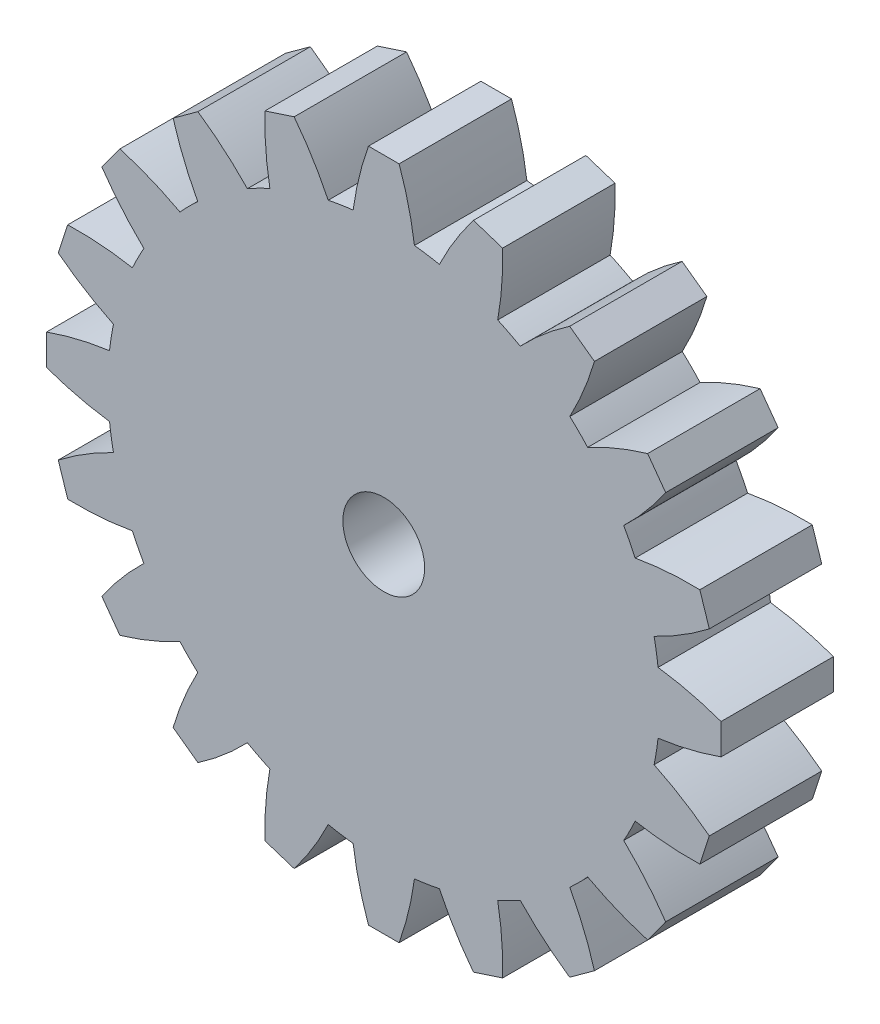
from build123d import *

# Parameters (mm, degrees)
SKETCH_1_R          = 13.5
EXTRUDE_1_DEPTH     = 5.5
EXTRUDE_START       = -5.5
EXTRUDE_2_DEPTH     = 5.5
SKETCH_7_R          = 2
CUT_EXTRUDE_1_DEPTH = 24.973944189
SKETCH_8_R          = 12.5
SKETCH_8_R_2        = 3
CUT_EXTRUDE_2_DEPTH = 4


with BuildPart() as part:
    # 草图1 → 凸台-拉伸1 (new body)
    with BuildSketch(Plane.XY):
        Circle(SKETCH_1_R)
    extrude(amount=EXTRUDE_1_DEPTH)

    # 草图6 → 凸台-拉伸2 (add)
    with BuildSketch(Plane.XY.offset(5.5).offset(EXTRUDE_START)):
        with BuildLine():
            Line((5.812072794, 15.460669773), (4.38548802, 15.924195265))
            ThreePointArc((4.38548802, 15.924195265), (3.48195608, 14.617198294), (2.719313259, 13.223287617))
            ThreePointArc((2.719313259, 13.223287617), (4.171729424, 12.83926297), (5.572482808, 12.296236634))
            ThreePointArc((5.572482808, 12.296236634), (5.774811944, 13.872204263), (5.812072794, 15.460669773))
        make_face()
        with BuildLine():
            Line((10.305219409, 12.907941468), (9.091693917, 13.789619346))
            ThreePointArc((9.091693917, 13.789619346), (7.828499702, 12.825798085), (6.67244119, 11.735779845))
            ThreePointArc((6.67244119, 11.735779845), (7.935100906, 10.921729424), (9.099492173, 9.972424088))
            ThreePointArc((9.099492173, 9.972424088), (9.778919397, 11.40873523), (10.305219409, 12.907941468))
        make_face()
        with BuildLine():
            Line((0.75, 16.5), (-0.75, 16.5))
            ThreePointArc((-0.75, 16.5), (-1.205425663, 14.97776529), (-1.5, 13.416407865))
            ThreePointArc((-1.5, 13.416407865), (0, 13.5), (1.5, 13.416407865))
            ThreePointArc((1.5, 13.416407865), (1.205425663, 14.97776529), (0.75, 16.5))
        make_face()
        with BuildLine():
            Line((13.789619346, 9.091693917), (12.907941468, 10.305219409))
            ThreePointArc((12.907941468, 10.305219409), (11.40873523, 9.778919397), (9.972424088, 9.099492173))
            ThreePointArc((9.972424088, 9.099492173), (10.921729424, 7.935100906), (11.735779845, 6.67244119))
            ThreePointArc((11.735779845, 6.67244119), (12.825798085, 7.828499702), (13.789619346, 9.091693917))
        make_face()
        with BuildLine():
            Line((15.924195265, 4.38548802), (15.460669773, 5.812072794))
            ThreePointArc((15.460669773, 5.812072794), (13.872204263, 5.774811944), (12.296236634, 5.572482808))
            ThreePointArc((12.296236634, 5.572482808), (12.83926297, 4.171729424), (13.223287617, 2.719313259))
            ThreePointArc((13.223287617, 2.719313259), (14.617198294, 3.48195608), (15.924195265, 4.38548802))
        make_face()
        with BuildLine():
            Line((16.5, -0.75), (16.5, 0.75))
            ThreePointArc((16.5, 0.75), (14.97776529, 1.205425663), (13.416407865, 1.5))
            ThreePointArc((13.416407865, 1.5), (13.5, 0), (13.416407865, -1.5))
            ThreePointArc((13.416407865, -1.5), (14.97776529, -1.205425663), (16.5, -0.75))
        make_face()
        with BuildLine():
            Line((15.460669773, -5.812072794), (15.924195265, -4.38548802))
            ThreePointArc((15.924195265, -4.38548802), (14.617198294, -3.48195608), (13.223287617, -2.719313259))
            ThreePointArc((13.223287617, -2.719313259), (12.83926297, -4.171729424), (12.296236634, -5.572482808))
            ThreePointArc((12.296236634, -5.572482808), (13.872204263, -5.774811944), (15.460669773, -5.812072794))
        make_face()
        with BuildLine():
            Line((12.907941468, -10.305219409), (13.789619346, -9.091693917))
            ThreePointArc((13.789619346, -9.091693917), (12.825798085, -7.828499702), (11.735779845, -6.67244119))
            ThreePointArc((11.735779845, -6.67244119), (10.921729424, -7.935100906), (9.972424088, -9.099492173))
            ThreePointArc((9.972424088, -9.099492173), (11.40873523, -9.778919397), (12.907941468, -10.305219409))
        make_face()
        with BuildLine():
            Line((9.091693917, -13.789619346), (10.305219409, -12.907941468))
            ThreePointArc((10.305219409, -12.907941468), (9.778919397, -11.40873523), (9.099492173, -9.972424088))
            ThreePointArc((9.099492173, -9.972424088), (7.935100906, -10.921729424), (6.67244119, -11.735779845))
            ThreePointArc((6.67244119, -11.735779845), (7.828499702, -12.825798085), (9.091693917, -13.789619346))
        make_face()
        with BuildLine():
            Line((4.38548802, -15.924195265), (5.812072794, -15.460669773))
            ThreePointArc((5.812072794, -15.460669773), (5.774811944, -13.872204263), (5.572482808, -12.296236634))
            ThreePointArc((5.572482808, -12.296236634), (4.171729424, -12.83926297), (2.719313259, -13.223287617))
            ThreePointArc((2.719313259, -13.223287617), (3.48195608, -14.617198294), (4.38548802, -15.924195265))
        make_face()
        with BuildLine():
            Line((-0.75, -16.5), (0.75, -16.5))
            ThreePointArc((0.75, -16.5), (1.205425663, -14.97776529), (1.5, -13.416407865))
            ThreePointArc((1.5, -13.416407865), (0, -13.5), (-1.5, -13.416407865))
            ThreePointArc((-1.5, -13.416407865), (-1.205425663, -14.97776529), (-0.75, -16.5))
        make_face()
        with BuildLine():
            Line((-5.812072794, -15.460669773), (-4.38548802, -15.924195265))
            ThreePointArc((-4.38548802, -15.924195265), (-3.48195608, -14.617198294), (-2.719313259, -13.223287617))
            ThreePointArc((-2.719313259, -13.223287617), (-4.171729424, -12.83926297), (-5.572482808, -12.296236634))
            ThreePointArc((-5.572482808, -12.296236634), (-5.774811944, -13.872204263), (-5.812072794, -15.460669773))
        make_face()
        with BuildLine():
            Line((-10.305219409, -12.907941468), (-9.091693917, -13.789619346))
            ThreePointArc((-9.091693917, -13.789619346), (-7.828499702, -12.825798085), (-6.67244119, -11.735779845))
            ThreePointArc((-6.67244119, -11.735779845), (-7.935100906, -10.921729424), (-9.099492173, -9.972424088))
            ThreePointArc((-9.099492173, -9.972424088), (-9.778919397, -11.40873523), (-10.305219409, -12.907941468))
        make_face()
        with BuildLine():
            Line((-13.789619346, -9.091693917), (-12.907941468, -10.305219409))
            ThreePointArc((-12.907941468, -10.305219409), (-11.40873523, -9.778919397), (-9.972424088, -9.099492173))
            ThreePointArc((-9.972424088, -9.099492173), (-10.921729424, -7.935100906), (-11.735779845, -6.67244119))
            ThreePointArc((-11.735779845, -6.67244119), (-12.825798085, -7.828499702), (-13.789619346, -9.091693917))
        make_face()
        with BuildLine():
            Line((-15.924195265, -4.38548802), (-15.460669773, -5.812072794))
            ThreePointArc((-15.460669773, -5.812072794), (-13.872204263, -5.774811944), (-12.296236634, -5.572482808))
            ThreePointArc((-12.296236634, -5.572482808), (-12.83926297, -4.171729424), (-13.223287617, -2.719313259))
            ThreePointArc((-13.223287617, -2.719313259), (-14.617198294, -3.48195608), (-15.924195265, -4.38548802))
        make_face()
        with BuildLine():
            Line((-16.5, 0.75), (-16.5, -0.75))
            ThreePointArc((-16.5, -0.75), (-14.97776529, -1.205425663), (-13.416407865, -1.5))
            ThreePointArc((-13.416407865, -1.5), (-13.5, 0), (-13.416407865, 1.5))
            ThreePointArc((-13.416407865, 1.5), (-14.97776529, 1.205425663), (-16.5, 0.75))
        make_face()
        with BuildLine():
            Line((-15.460669773, 5.812072794), (-15.924195265, 4.38548802))
            ThreePointArc((-15.924195265, 4.38548802), (-14.617198294, 3.48195608), (-13.223287617, 2.719313259))
            ThreePointArc((-13.223287617, 2.719313259), (-12.83926297, 4.171729424), (-12.296236634, 5.572482808))
            ThreePointArc((-12.296236634, 5.572482808), (-13.872204263, 5.774811944), (-15.460669773, 5.812072794))
        make_face()
        with BuildLine():
            Line((-12.907941468, 10.305219409), (-13.789619346, 9.091693917))
            ThreePointArc((-13.789619346, 9.091693917), (-12.825798085, 7.828499702), (-11.735779845, 6.67244119))
            ThreePointArc((-11.735779845, 6.67244119), (-10.921729424, 7.935100906), (-9.972424088, 9.099492173))
            ThreePointArc((-9.972424088, 9.099492173), (-11.40873523, 9.778919397), (-12.907941468, 10.305219409))
        make_face()
        with BuildLine():
            Line((-9.091693917, 13.789619346), (-10.305219409, 12.907941468))
            ThreePointArc((-10.305219409, 12.907941468), (-9.778919397, 11.40873523), (-9.099492173, 9.972424088))
            ThreePointArc((-9.099492173, 9.972424088), (-7.935100906, 10.921729424), (-6.67244119, 11.735779845))
            ThreePointArc((-6.67244119, 11.735779845), (-7.828499702, 12.825798085), (-9.091693917, 13.789619346))
        make_face()
        with BuildLine():
            Line((-4.38548802, 15.924195265), (-5.812072794, 15.460669773))
            ThreePointArc((-5.812072794, 15.460669773), (-5.774811944, 13.872204263), (-5.572482808, 12.296236634))
            ThreePointArc((-5.572482808, 12.296236634), (-4.171729424, 12.83926297), (-2.719313259, 13.223287617))
            ThreePointArc((-2.719313259, 13.223287617), (-3.48195608, 14.617198294), (-4.38548802, 15.924195265))
        make_face()
    extrude(amount=EXTRUDE_2_DEPTH)

    # 草图7 → 切除-拉伸1 (cut, through all)
    with BuildSketch(Plane(origin=(0, 0, 0), x_dir=(-1, 0, 0), z_dir=(0, 0, -1))):
        Circle(SKETCH_7_R)
    extrude(amount=-CUT_EXTRUDE_1_DEPTH, mode=Mode.SUBTRACT)

    # 草图8 → 切除-拉伸2 (cut)
    with BuildSketch(Plane(origin=(0, 0, 0), x_dir=(-1, 0, 0), z_dir=(0, 0, -1))):
        Circle(SKETCH_8_R)
        Circle(SKETCH_8_R_2, mode=Mode.SUBTRACT)
    extrude(amount=-CUT_EXTRUDE_2_DEPTH, mode=Mode.SUBTRACT)


solid = part.part
